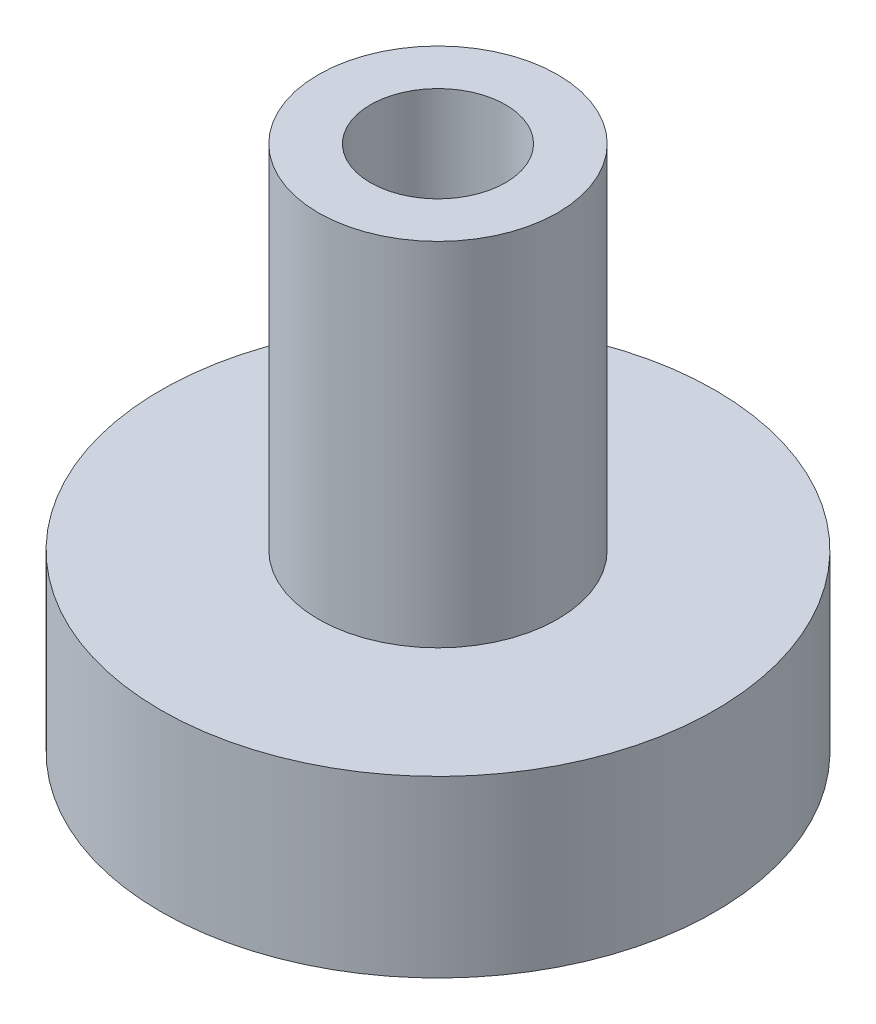
from build123d import *

# Parameters (mm, degrees)
CUT_EXTRUDE1_REACH = 13.843
SKETCH2_R          = 1.2192


with BuildPart() as part:
    # Sketch1 → Revolve1 (revolve)
    with BuildSketch(Plane.XY, mode=Mode.PRIVATE) as revolve1_sk:
        Polygon((0, 0), (-2.159, 0), (-2.159, -6.35), (-5, -6.35), (-5, -9.5), (0, -9.5), align=None)
    revolve(revolve1_sk.sketch.rotate(Axis((0, -9.5, 0), (0, 1, 0)), 270), axis=Axis((0, -9.5, 0), (0, 1, 0)))

    # Sketch2 → Cut-Extrude1 (cut, up to next)
    with BuildSketch(Plane(origin=(0, 0, 0), x_dir=(1, 0, 0), z_dir=(0, 1, 0)), mode=Mode.PRIVATE) as cut_extrude1_sk1:
        with Locations(Location((0, 0, 0), (0, 0, 270))):
            Circle(SKETCH2_R)
    cut_extrude1_tool1 = extrude(cut_extrude1_sk1.sketch, amount=-CUT_EXTRUDE1_REACH, mode=Mode.PRIVATE) & part.part
    add(cut_extrude1_tool1.solids().sort_by_distance((0, 0, 0))[0], mode=Mode.SUBTRACT)


solid = part.part
